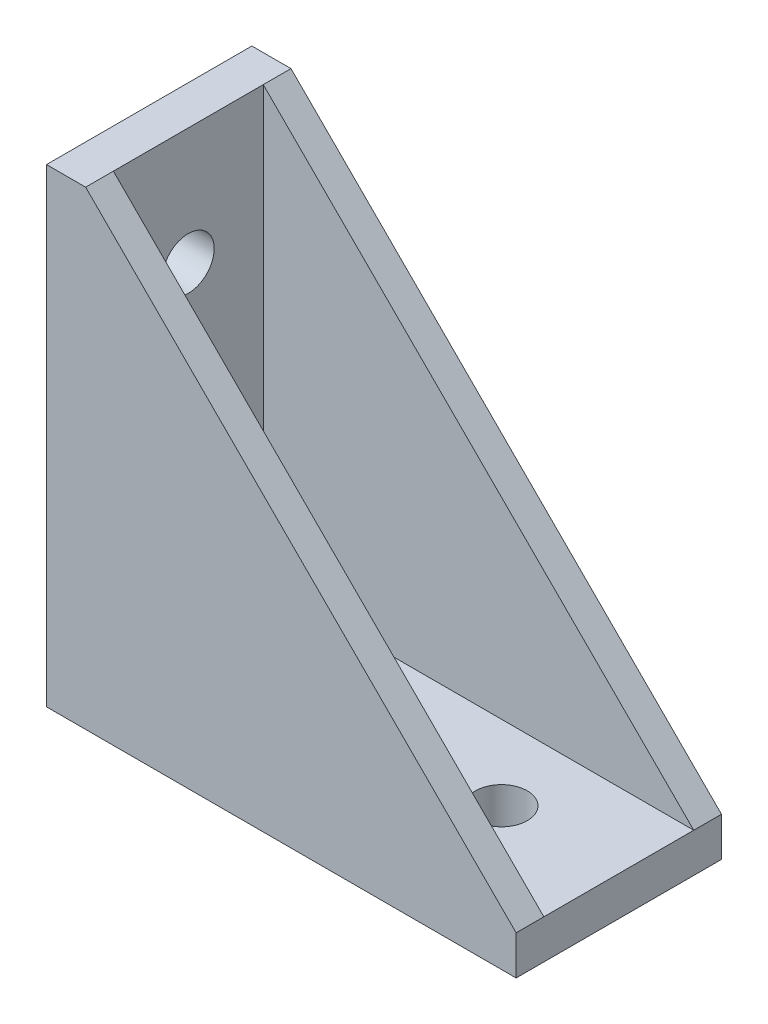
from build123d import *

# Parameters (mm, degrees)
BODY_DEPTH   = 33.32
POCKET_DEPTH = 24.32
SKETCH3_R    = 4.2
HOLESX_DEPTH = 6.35
SKETCH4_R    = 4.2
HOLESY_DEPTH = 6.35


with BuildPart() as part:
    # Sketch1 → Body (new body)
    with BuildSketch(Plane.XY.offset(-16.66)):
        Polygon((0, 0), (76.2, 0), (76.2, 6.35), (6.35, 76.2), (0, 76.2), align=None)
    extrude(amount=BODY_DEPTH)

    # Sketch2 → Pocket (cut)
    with BuildSketch(Plane.XY.offset(12.16)):
        Polygon((6.35, 6.35), (86.2, 6.35), (6.35, 86.2), align=None)
    extrude(amount=-POCKET_DEPTH, mode=Mode.SUBTRACT)

    # Sketch3 → HolesX (cut)
    with BuildSketch(Plane(origin=(0, 6.35, 0), x_dir=(1, 0, 0), z_dir=(0, 1, 0))):
        with Locations(Location((19.05, 0, 0), (0, 0, 270))):
            Circle(SKETCH3_R)
        with Locations(Location((57.15, 0, 0), (0, 0, 270))):
            Circle(SKETCH3_R)
    extrude(amount=-HOLESX_DEPTH, mode=Mode.SUBTRACT)

    # Sketch4 → HolesY (cut)
    with BuildSketch(Plane(origin=(6.35, 0, 0), x_dir=(0, 0, -1), z_dir=(1, 0, 0))):
        with Locations((0, 19.05)):
            Circle(SKETCH4_R)
        with Locations((0, 57.15)):
            Circle(SKETCH4_R)
    extrude(amount=-HOLESY_DEPTH, mode=Mode.SUBTRACT)


solid = part.part
